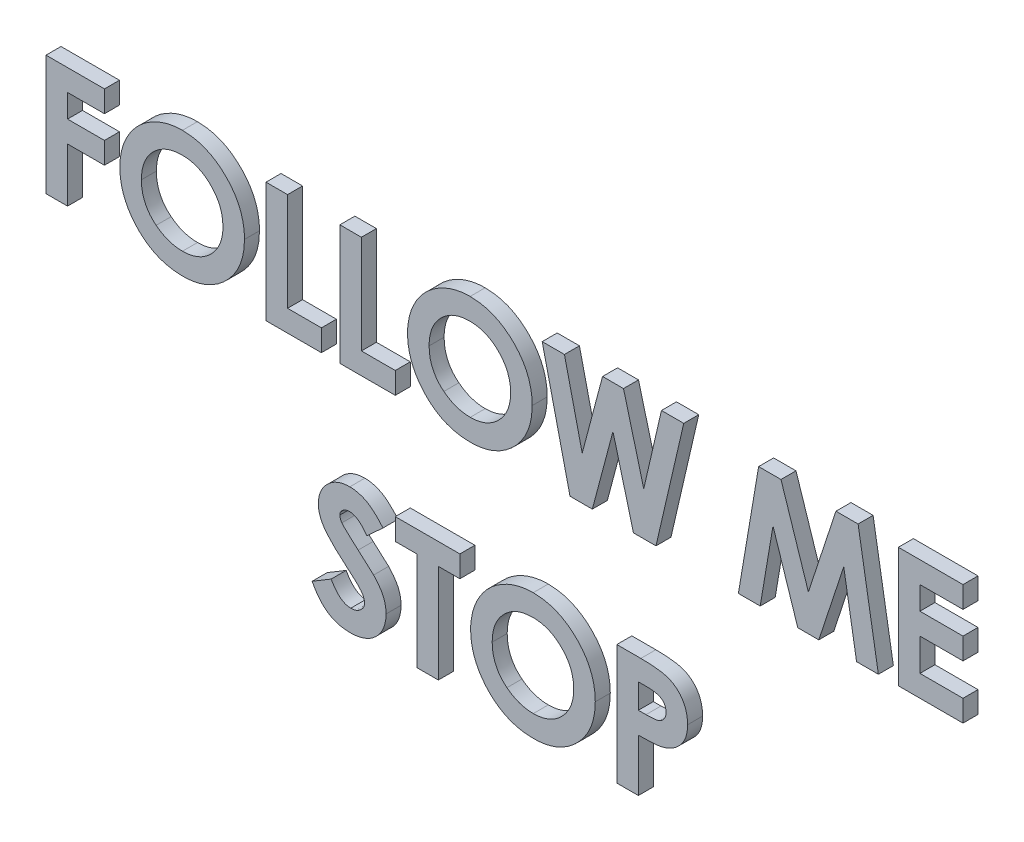
from build123d import *

# Parameters (mm, degrees)
BOSS_EXTRUDE1_DEPTH    = 1
BOSS_EXTRUDE1_2_DEPTH  = 1
BOSS_EXTRUDE1_3_DEPTH  = 1
BOSS_EXTRUDE1_4_DEPTH  = 1
BOSS_EXTRUDE1_5_DEPTH  = 1
BOSS_EXTRUDE1_6_DEPTH  = 1
BOSS_EXTRUDE1_7_DEPTH  = 1
BOSS_EXTRUDE1_8_DEPTH  = 1
BOSS_EXTRUDE1_9_DEPTH  = 1
BOSS_EXTRUDE1_10_DEPTH = 1
BOSS_EXTRUDE1_11_DEPTH = 1
BOSS_EXTRUDE1_12_DEPTH = 1


with BuildPart() as part:
    # Sketch1 → Boss-Extrude1 (new body)
    with BuildSketch(Plane.XY):
        Polygon((7.141025641, 29), (11.038461538, 29), (11.038461538, 27.564102564), (8.576923077, 27.564102564), (8.576923077, 26.025641026), (11.038461538, 26.025641026), (11.038461538, 24.58974359), (8.576923077, 24.58974359), (8.576923077, 21), (7.141025641, 21), align=None)
    extrude(amount=BOSS_EXTRUDE1_DEPTH)


with BuildPart() as body_2:
    # Sketch1 → Boss-Extrude1 2 (new body)
    with BuildSketch(Plane.XY):
        with BuildLine():
            add(Edge.make_bspline(
                [(16.233974359, 29.205128205), (16.373064163, 29.201526921), (16.647658941, 29.19441717), (17.051488767, 29.135151851), (17.440653473, 29.038587509), (17.814977079, 28.90435609), (18.173522321, 28.728821924), (18.517553909, 28.51696152), (18.845839539, 28.26477614), (19.155015201, 27.978148853), (19.440749275, 27.666454193), (19.688338016, 27.330859477), (19.899472611, 26.980060302), (20.074461529, 26.613116689), (20.207748161, 26.22748738), (20.301280903, 25.825138574), (20.361371056, 25.406184737), (20.368282348, 25.120934277), (20.371794872, 24.975961538)],
                knots=[0, 0, 0, 0, 1.014329547, 2.002516266, 2.970391464, 3.935626869, 4.897733899, 5.877609409, 6.878433252, 7.912639331, 8.949961323, 9.958554974, 10.949718813, 11.932905612, 12.9188844, 13.919928257, 14.942845884, 16, 16, 16, 16], degree=3))
            add(Edge.make_bspline(
                [(20.371794872, 24.975961538), (20.368054186, 24.832622308), (20.360683045, 24.550167754), (20.303734046, 24.135074742), (20.208626201, 23.73703593), (20.077600215, 23.35515035), (19.905784935, 22.991267724), (19.698767694, 22.643064713), (19.4510857, 22.313772723), (19.17177289, 22.003568465), (18.864273725, 21.721991539), (18.538583295, 21.473852359), (18.196205437, 21.263588582), (17.837641282, 21.091296519), (17.462121907, 20.957586994), (17.070574891, 20.863245208), (16.663024462, 20.8059118), (16.385870407, 20.798588806), (16.245192308, 20.794871795)],
                knots=[0, 0, 0, 0, 1.051557043, 2.072126891, 3.067553643, 4.050577992, 5.02905126, 6.015227836, 7.017913613, 8.04756643, 9.074058332, 10.072836633, 11.047628519, 12.017157415, 12.98668631, 13.966869689, 14.968021931, 16, 16, 16, 16], degree=3))
            add(Edge.make_bspline(
                [(16.245192308, 20.794871795), (16.098059884, 20.798206137), (15.808964783, 20.804757665), (15.385872809, 20.867059697), (14.980514139, 20.960908322), (14.596294021, 21.100972361), (14.229299499, 21.276064186), (13.882226992, 21.491700266), (13.555193138, 21.747524246), (13.250073856, 22.036984379), (12.973635048, 22.353717252), (12.729623577, 22.688317446), (12.523794488, 23.038228907), (12.35614025, 23.403615404), (12.223968384, 23.782206146), (12.130736149, 24.176306862), (12.075661644, 24.584972355), (12.067990085, 24.862546127), (12.064102564, 25.003205128)],
                knots=[0, 0, 0, 0, 1.067978421, 2.098431617, 3.099715153, 4.085208694, 5.062210972, 6.048429807, 7.046490867, 8.072918869, 9.098532598, 10.095778865, 11.076610158, 12.041847152, 13.011192615, 13.984257998, 14.978533688, 16, 16, 16, 16], degree=3))
            add(Edge.make_bspline(
                [(12.064102564, 25.003205128), (12.065322692, 25.097833141), (12.067747498, 25.285890958), (12.096956845, 25.564583044), (12.139009906, 25.837835435), (12.201204388, 26.104558669), (12.276754787, 26.366634355), (12.374641001, 26.621623027), (12.486062003, 26.872248666), (12.616246954, 27.115551069), (12.761000031, 27.349291651), (12.918938525, 27.572367816), (13.090459572, 27.782082248), (13.275010645, 27.979813103), (13.473227731, 28.164260682), (13.682503491, 28.338036098), (13.906896654, 28.496523257), (14.141495959, 28.643592732), (14.384978789, 28.776585108), (14.636353947, 28.88978424), (14.89044261, 28.988639115), (15.150639058, 29.066659753), (15.414154824, 29.130206746), (15.683805041, 29.172231464), (15.957153571, 29.201440001), (16.141481779, 29.203895886), (16.233974359, 29.205128205)],
                knots=[0, 0, 0, 0, 1.034744296, 2.056386356, 3.06226378, 4.057406941, 5.050368692, 6.043467995, 7.042652155, 8.049140477, 9.059438543, 10.048523776, 11.036952808, 12.020949711, 13.004946614, 13.997082645, 14.994316842, 16.007702937, 17.024872941, 18.026463647, 19.021641123, 20.005082605, 20.995858141, 21.984425357, 22.988620895, 24, 24, 24, 24], degree=3))
        make_face()
        with BuildLine():
            add(Edge.make_bspline(
                [(16.211538462, 27.769230769), (16.117931042, 27.766719072), (15.933187453, 27.761761987), (15.662202253, 27.723995701), (15.402046891, 27.663678651), (15.154163511, 27.576310141), (14.917477765, 27.465112201), (14.691570083, 27.330473372), (14.479568819, 27.167765593), (14.278647141, 26.985723921), (14.097147466, 26.782887662), (13.936786779, 26.565514114), (13.802590712, 26.333966289), (13.690200665, 26.090395209), (13.605595869, 25.832061984), (13.54533441, 25.560990165), (13.507251417, 25.276712682), (13.502451008, 25.082921092), (13.5, 24.983974359)],
                knots=[0, 0, 0, 0, 1.033739768, 2.040188636, 3.016340934, 3.979330865, 4.937572243, 5.900995986, 6.878200029, 7.884839167, 8.891893314, 9.879764717, 10.863503415, 11.843163062, 12.837761627, 13.859916423, 14.907309254, 16, 16, 16, 16], degree=3))
            add(Edge.make_bspline(
                [(13.5, 24.983974359), (13.503249662, 24.874319122), (13.509618462, 24.659413025), (13.554430113, 24.345913802), (13.631098388, 24.0498449), (13.741805885, 23.772654349), (13.879112227, 23.511264155), (14.049624911, 23.268878026), (14.250582439, 23.044044668), (14.405398491, 22.912777588), (14.483974359, 22.846153846)],
                knots=[0, 0, 0, 0, 1.078454662, 2.113592447, 3.107694534, 4.079536787, 5.043276885, 6.005368276, 6.987637804, 8, 8, 8, 8], degree=3))
            add(Edge.make_bspline(
                [(14.483974359, 22.846153846), (14.548342996, 22.796934785), (14.675630033, 22.699605575), (14.878807856, 22.574858227), (15.088041007, 22.467937305), (15.304908411, 22.381546465), (15.528952056, 22.313592882), (15.760141219, 22.266006106), (15.998148323, 22.236141288), (16.159099881, 22.232571877), (16.240384615, 22.230769231)],
                knots=[0, 0, 0, 0, 1.023928204, 2.024787132, 3.009472467, 3.9914905, 4.972207045, 5.96565515, 6.972602802, 8, 8, 8, 8], degree=3))
            add(Edge.make_bspline(
                [(16.240384615, 22.230769231), (16.332382454, 22.233302224), (16.513391093, 22.238285969), (16.779331758, 22.275587331), (17.034110991, 22.338714702), (17.279310485, 22.425316785), (17.514223194, 22.537910911), (17.737701035, 22.676725814), (17.950135825, 22.840057027), (18.150801532, 23.024489306), (18.334219474, 23.228124599), (18.494245522, 23.446657595), (18.632708353, 23.675273356), (18.742761247, 23.917207593), (18.830708587, 24.170176559), (18.890244769, 24.4353006), (18.928649477, 24.711486773), (18.933451238, 24.899441224), (18.935897436, 24.995192308)],
                knots=[0, 0, 0, 0, 1.026359118, 2.019393844, 2.989460624, 3.950973911, 4.916101784, 5.890408035, 6.881132271, 7.902007068, 8.92769091, 9.933912415, 10.920395702, 11.90457117, 12.894218921, 13.903490204, 14.931958862, 16, 16, 16, 16], degree=3))
            add(Edge.make_bspline(
                [(18.935897436, 24.995192308), (18.933366599, 25.090392797), (18.928385032, 25.27778044), (18.891018018, 25.55325654), (18.828290984, 25.817210136), (18.741428844, 26.070072291), (18.630510492, 26.312090904), (18.493348696, 26.542414895), (18.330424741, 26.760821597), (18.145488312, 26.965822652), (17.944196376, 27.154205489), (17.728089369, 27.317687547), (17.503214209, 27.459748258), (17.264411162, 27.571032883), (17.016565938, 27.659693107), (16.758166173, 27.724983769), (16.488233162, 27.761496677), (16.304592153, 27.766629759), (16.211538462, 27.769230769)],
                knots=[0, 0, 0, 0, 1.055025985, 2.07665775, 3.074803781, 4.057872707, 5.035505728, 6.020516407, 7.023567878, 8.050795229, 9.077271434, 10.074415901, 11.050397877, 12.019801805, 12.988065821, 13.964604439, 14.968634123, 16, 16, 16, 16], degree=3))
        make_face(mode=Mode.SUBTRACT)
    extrude(amount=BOSS_EXTRUDE1_2_DEPTH)


with BuildPart() as body_3:
    # Sketch1 → Boss-Extrude1 3 (new body)
    with BuildSketch(Plane.XY):
        Polygon((21.807692308, 29), (23.243589744, 29), (23.243589744, 22.435897436), (25.5, 22.435897436), (25.5, 21), (21.807692308, 21), align=None)
    extrude(amount=BOSS_EXTRUDE1_3_DEPTH)


with BuildPart() as body_4:
    # Sketch1 → Boss-Extrude1 4 (new body)
    with BuildSketch(Plane.XY):
        Polygon((26.730769231, 29), (28.166666667, 29), (28.166666667, 22.435897436), (30.423076923, 22.435897436), (30.423076923, 21), (26.730769231, 21), align=None)
    extrude(amount=BOSS_EXTRUDE1_4_DEPTH)


with BuildPart() as body_5:
    # Sketch1 → Boss-Extrude1 5 (new body)
    with BuildSketch(Plane.XY):
        with BuildLine():
            add(Edge.make_bspline(
                [(35.413461538, 29.205128205), (35.552551343, 29.201526921), (35.82714612, 29.19441717), (36.230975947, 29.135151851), (36.620140652, 29.038587509), (36.994464258, 28.90435609), (37.353009501, 28.728821924), (37.697041089, 28.51696152), (38.025326718, 28.26477614), (38.334502381, 27.978148853), (38.620236454, 27.666454193), (38.867825195, 27.330859477), (39.078959791, 26.980060302), (39.253948708, 26.613116689), (39.38723534, 26.22748738), (39.480768083, 25.825138574), (39.540858236, 25.406184737), (39.547769528, 25.120934277), (39.551282051, 24.975961538)],
                knots=[0, 0, 0, 0, 1.014329547, 2.002516266, 2.970391464, 3.935626869, 4.897733899, 5.877609409, 6.878433252, 7.912639331, 8.949961323, 9.958554974, 10.949718813, 11.932905612, 12.9188844, 13.919928257, 14.942845884, 16, 16, 16, 16], degree=3))
            add(Edge.make_bspline(
                [(39.551282051, 24.975961538), (39.547541366, 24.832622308), (39.540170225, 24.550167754), (39.483221226, 24.135074742), (39.38811338, 23.73703593), (39.257087394, 23.35515035), (39.085272114, 22.991267724), (38.878254873, 22.643064713), (38.63057288, 22.313772723), (38.351260069, 22.003568465), (38.043760905, 21.721991539), (37.718070475, 21.473852359), (37.375692617, 21.263588582), (37.017128462, 21.091296519), (36.641609087, 20.957586994), (36.25006207, 20.863245208), (35.842511642, 20.8059118), (35.565357586, 20.798588806), (35.424679487, 20.794871795)],
                knots=[0, 0, 0, 0, 1.051557043, 2.072126891, 3.067553643, 4.050577992, 5.02905126, 6.015227836, 7.017913613, 8.04756643, 9.074058332, 10.072836633, 11.047628519, 12.017157415, 12.98668631, 13.966869689, 14.968021931, 16, 16, 16, 16], degree=3))
            add(Edge.make_bspline(
                [(35.424679487, 20.794871795), (35.277547064, 20.798206137), (34.988451963, 20.804757665), (34.565359988, 20.867059697), (34.160001319, 20.960908322), (33.7757812, 21.100972361), (33.408786679, 21.276064186), (33.061714171, 21.491700266), (32.734680317, 21.747524246), (32.429561036, 22.036984379), (32.153122228, 22.353717252), (31.909110756, 22.688317446), (31.703281667, 23.038228907), (31.535627429, 23.403615404), (31.403455563, 23.782206146), (31.310223329, 24.176306862), (31.255148823, 24.584972355), (31.247477264, 24.862546127), (31.243589744, 25.003205128)],
                knots=[0, 0, 0, 0, 1.067978421, 2.098431617, 3.099715153, 4.085208694, 5.062210972, 6.048429807, 7.046490867, 8.072918869, 9.098532598, 10.095778865, 11.076610158, 12.041847152, 13.011192615, 13.984257998, 14.978533688, 16, 16, 16, 16], degree=3))
            add(Edge.make_bspline(
                [(31.243589744, 25.003205128), (31.244809872, 25.097833141), (31.247234678, 25.285890958), (31.276444024, 25.564583044), (31.318497085, 25.837835435), (31.380691567, 26.104558669), (31.456241966, 26.366634355), (31.55412818, 26.621623027), (31.665549183, 26.872248666), (31.795734133, 27.115551069), (31.94048721, 27.349291651), (32.098425705, 27.572367816), (32.269946752, 27.782082248), (32.454497824, 27.979813103), (32.652714911, 28.164260682), (32.86199067, 28.338036098), (33.086383833, 28.496523257), (33.320983138, 28.643592732), (33.564465968, 28.776585108), (33.815841127, 28.88978424), (34.069929789, 28.988639115), (34.330126238, 29.066659753), (34.593642004, 29.130206746), (34.86329222, 29.172231464), (35.136640751, 29.201440001), (35.320968959, 29.203895886), (35.413461538, 29.205128205)],
                knots=[0, 0, 0, 0, 1.034744296, 2.056386356, 3.06226378, 4.057406941, 5.050368692, 6.043467995, 7.042652155, 8.049140477, 9.059438543, 10.048523776, 11.036952808, 12.020949711, 13.004946614, 13.997082645, 14.994316842, 16.007702937, 17.024872941, 18.026463647, 19.021641123, 20.005082605, 20.995858141, 21.984425357, 22.988620895, 24, 24, 24, 24], degree=3))
        make_face()
        with BuildLine():
            add(Edge.make_bspline(
                [(35.391025641, 27.769230769), (35.297418221, 27.766719072), (35.112674632, 27.761761987), (34.841689432, 27.723995701), (34.58153407, 27.663678651), (34.33365069, 27.576310141), (34.096964945, 27.465112201), (33.871057263, 27.330473372), (33.659055998, 27.167765593), (33.45813432, 26.985723921), (33.276634646, 26.782887662), (33.116273958, 26.565514114), (32.982077891, 26.333966289), (32.869687845, 26.090395209), (32.785083049, 25.832061984), (32.724821589, 25.560990165), (32.686738596, 25.276712682), (32.681938188, 25.082921092), (32.679487179, 24.983974359)],
                knots=[0, 0, 0, 0, 1.033739768, 2.040188636, 3.016340934, 3.979330865, 4.937572243, 5.900995986, 6.878200029, 7.884839167, 8.891893314, 9.879764717, 10.863503415, 11.843163062, 12.837761627, 13.859916423, 14.907309254, 16, 16, 16, 16], degree=3))
            add(Edge.make_bspline(
                [(32.679487179, 24.983974359), (32.682736842, 24.874319122), (32.689105642, 24.659413025), (32.733917293, 24.345913802), (32.810585567, 24.0498449), (32.921293065, 23.772654349), (33.058599406, 23.511264155), (33.22911209, 23.268878026), (33.430069619, 23.044044668), (33.584885671, 22.912777588), (33.663461538, 22.846153846)],
                knots=[0, 0, 0, 0, 1.078454662, 2.113592447, 3.107694534, 4.079536787, 5.043276885, 6.005368276, 6.987637804, 8, 8, 8, 8], degree=3))
            add(Edge.make_bspline(
                [(33.663461538, 22.846153846), (33.727830175, 22.796934785), (33.855117212, 22.699605575), (34.058295036, 22.574858227), (34.267528186, 22.467937305), (34.48439559, 22.381546465), (34.708439235, 22.313592882), (34.939628398, 22.266006106), (35.177635503, 22.236141288), (35.338587061, 22.232571877), (35.419871795, 22.230769231)],
                knots=[0, 0, 0, 0, 1.023928204, 2.024787132, 3.009472467, 3.9914905, 4.972207045, 5.96565515, 6.972602802, 8, 8, 8, 8], degree=3))
            add(Edge.make_bspline(
                [(35.419871795, 22.230769231), (35.511869633, 22.233302224), (35.692878273, 22.238285969), (35.958818937, 22.275587331), (36.213598171, 22.338714702), (36.458797665, 22.425316785), (36.693710373, 22.537910911), (36.917188214, 22.676725814), (37.129623005, 22.840057027), (37.330288712, 23.024489306), (37.513706653, 23.228124599), (37.673732701, 23.446657595), (37.812195533, 23.675273356), (37.922248426, 23.917207593), (38.010195767, 24.170176559), (38.069731948, 24.4353006), (38.108136656, 24.711486773), (38.112938417, 24.899441224), (38.115384615, 24.995192308)],
                knots=[0, 0, 0, 0, 1.026359118, 2.019393844, 2.989460624, 3.950973911, 4.916101784, 5.890408035, 6.881132271, 7.902007068, 8.92769091, 9.933912415, 10.920395702, 11.90457117, 12.894218921, 13.903490204, 14.931958862, 16, 16, 16, 16], degree=3))
            add(Edge.make_bspline(
                [(38.115384615, 24.995192308), (38.112853778, 25.090392797), (38.107872212, 25.27778044), (38.070505198, 25.55325654), (38.007778164, 25.817210136), (37.920916024, 26.070072291), (37.809997671, 26.312090904), (37.672835876, 26.542414895), (37.509911921, 26.760821597), (37.324975492, 26.965822652), (37.123683555, 27.154205489), (36.907576549, 27.317687547), (36.682701388, 27.459748258), (36.443898341, 27.571032883), (36.196053117, 27.659693107), (35.937653352, 27.724983769), (35.667720341, 27.761496677), (35.484079332, 27.766629759), (35.391025641, 27.769230769)],
                knots=[0, 0, 0, 0, 1.055025985, 2.07665775, 3.074803781, 4.057872707, 5.035505728, 6.020516407, 7.023567878, 8.050795229, 9.077271434, 10.074415901, 11.050397877, 12.019801805, 12.988065821, 13.964604439, 14.968634123, 16, 16, 16, 16], degree=3))
        make_face(mode=Mode.SUBTRACT)
    extrude(amount=BOSS_EXTRUDE1_5_DEPTH)


with BuildPart() as body_6:
    # Sketch1 → Boss-Extrude1 6 (new body)
    with BuildSketch(Plane.XY):
        Polygon((40.217948718, 29), (41.700320513, 29), (42.884615385, 23.892628205), (44.241987179, 29), (45.637820513, 29), (46.987179487, 23.892628205), (48.168269231, 29), (49.653846154, 29), (47.802884615, 21), (46.302884615, 21), (44.935897436, 26.171474359), (43.560897436, 21), (42.072115385, 21), align=None)
    extrude(amount=BOSS_EXTRUDE1_6_DEPTH)


with BuildPart() as body_7:
    # Sketch1 → Boss-Extrude1 7 (new body)
    with BuildSketch(Plane.XY):
        Polygon((54.645833333, 29), (56.136217949, 29), (57.961538462, 23.419871795), (59.799679487, 29), (61.275641026, 29), (62.628205128, 21), (61.174679487, 21), (60.320512821, 26.052884615), (58.657051282, 21), (57.256410256, 21), (55.602564103, 26.052884615), (54.75, 21), (53.294871795, 21), align=None)
    extrude(amount=BOSS_EXTRUDE1_7_DEPTH)


with BuildPart() as body_8:
    # Sketch1 → Boss-Extrude1 8 (new body)
    with BuildSketch(Plane.XY):
        Polygon((63.961538462, 29), (68.269230769, 29), (68.269230769, 27.564102564), (65.397435897, 27.564102564), (65.397435897, 26.025641026), (68.269230769, 26.025641026), (68.269230769, 24.58974359), (65.397435897, 24.58974359), (65.397435897, 22.435897436), (68.269230769, 22.435897436), (68.269230769, 21), (63.961538462, 21), align=None)
    extrude(amount=BOSS_EXTRUDE1_8_DEPTH)


with BuildPart() as body_9:
    # Sketch1 → Boss-Extrude1 9 (new body)
    with BuildSketch(Plane.XY):
        with BuildLine():
            Line((29.602564103, 12.931089744), (28.528846154, 11.948717949))
            add(Edge.make_bspline(
                [(28.528846154, 11.948717949), (28.482852681, 12.013596524), (28.394551627, 12.13815434), (28.251424828, 12.304940193), (28.108944321, 12.447220936), (27.965790109, 12.564402189), (27.820693328, 12.655771987), (27.673905845, 12.720462813), (27.526259839, 12.761587385), (27.427064515, 12.766708384), (27.378205128, 12.769230769)],
                knots=[0, 0, 0, 0, 1.299362458, 2.494594718, 3.587462134, 4.587049575, 5.512617175, 6.380583204, 7.202344345, 8, 8, 8, 8], degree=3))
            add(Edge.make_bspline(
                [(27.378205128, 12.769230769), (27.332630494, 12.76763247), (27.244637848, 12.764546574), (27.119197804, 12.733873), (27.007830347, 12.680934914), (26.910644166, 12.611713914), (26.833658372, 12.528318657), (26.772191185, 12.440858475), (26.737579994, 12.344322214), (26.73302448, 12.278017215), (26.730769231, 12.245192308)],
                knots=[0, 0, 0, 0, 1.185010067, 2.2879431, 3.333075148, 4.379039566, 5.372662701, 6.27520591, 7.14612461, 8, 8, 8, 8], degree=3))
            add(Edge.make_bspline(
                [(26.730769231, 12.245192308), (26.732182481, 12.21189405), (26.735028572, 12.144835988), (26.762517929, 12.046554046), (26.80395224, 11.950521147), (26.843544415, 11.892061352), (26.863782051, 11.862179487)],
                knots=[0, 0, 0, 0, 0.967525499, 1.948461899, 2.951351359, 4, 4, 4, 4], degree=3))
            add(Edge.make_bspline(
                [(26.863782051, 11.862179487), (26.882180252, 11.838952626), (26.924530479, 11.78548746), (27.005283688, 11.70080697), (27.10669276, 11.597065958), (27.232660128, 11.477831774), (27.377956541, 11.338816288), (27.549316675, 11.185484254), (27.741808038, 11.013087156), (27.878626439, 10.89303606), (27.950320513, 10.830128205)],
                knots=[0, 0, 0, 0, 0.473873513, 1.090794244, 1.870441696, 2.795289791, 3.865433203, 5.087734844, 6.473946851, 8, 8, 8, 8], degree=3))
            add(Edge.make_bspline(
                [(27.950320513, 10.830128205), (28.017615714, 10.771887603), (28.145328024, 10.66135904), (28.327037281, 10.504481491), (28.486729454, 10.363342586), (28.626730895, 10.240060517), (28.744919317, 10.133341773), (28.841791585, 10.04267624), (28.918530831, 9.969829009), (28.962152598, 9.925829237), (28.980769231, 9.907051282)],
                knots=[0, 0, 0, 0, 1.543621617, 2.929473131, 4.163658386, 5.240097082, 6.164993805, 6.925417477, 7.541396219, 8, 8, 8, 8], degree=3))
            add(Edge.make_bspline(
                [(28.980769231, 9.907051282), (29.051396852, 9.830617069), (29.187167945, 9.68368367), (29.363622502, 9.45598311), (29.50885031, 9.233700934), (29.621201297, 9.012654544), (29.706053281, 8.789654678), (29.765875053, 8.559232278), (29.801702711, 8.318979574), (29.805680418, 8.155036433), (29.807692308, 8.072115385)],
                knots=[0, 0, 0, 0, 1.206664779, 2.319633467, 3.337109185, 4.282041471, 5.190008762, 6.099243693, 7.03861361, 8, 8, 8, 8], degree=3))
            add(Edge.make_bspline(
                [(29.807692308, 8.072115385), (29.806260296, 7.991318993), (29.803450635, 7.832793465), (29.769037681, 7.600814968), (29.719966827, 7.378801479), (29.644094679, 7.169168817), (29.551622154, 6.968475928), (29.435694489, 6.779848967), (29.299553342, 6.601378953), (29.143514684, 6.436256255), (28.970917399, 6.286418853), (28.785790409, 6.153030058), (28.586323446, 6.042900617), (28.374220727, 5.952216877), (28.149595784, 5.882371049), (27.912716214, 5.830748472), (27.663219694, 5.799765415), (27.492610378, 5.796526504), (27.405448718, 5.794871795)],
                knots=[0, 0, 0, 0, 1.043214005, 2.046824704, 3.02475056, 3.976699089, 4.921714032, 5.875962561, 6.831408892, 7.817874052, 8.806269674, 9.781291748, 10.760897367, 11.74438705, 12.757449933, 13.795994037, 14.874007457, 16, 16, 16, 16], degree=3))
            add(Edge.make_bspline(
                [(27.405448718, 5.794871795), (27.337027557, 5.796085632), (27.20151442, 5.798489725), (27.001788542, 5.818117146), (26.808930629, 5.849793716), (26.623157919, 5.895195702), (26.443633472, 5.952726176), (26.270349916, 6.022997447), (26.104503483, 6.107098693), (25.944839303, 6.203300457), (25.79213354, 6.315003377), (25.644455288, 6.439923723), (25.50327143, 6.579982827), (25.367903887, 6.734849454), (25.239218779, 6.904962148), (25.113003781, 7.087951777), (24.994868266, 7.287214378), (24.921890704, 7.426998705), (24.884615385, 7.498397436)],
                knots=[0, 0, 0, 0, 1.016823716, 2.013894106, 2.979844003, 3.91962641, 4.853723003, 5.779685073, 6.695824784, 7.614987388, 8.547259901, 9.504950863, 10.487499108, 11.500346958, 12.559593716, 13.656357062, 14.802919212, 16, 16, 16, 16], degree=3))
            Line((24.884615385, 7.498397436), (26.147435897, 8.256410256))
            add(Edge.make_bspline(
                [(26.147435897, 8.256410256), (26.19406175, 8.175363368), (26.283447495, 8.019989555), (26.434919996, 7.811225146), (26.590095841, 7.632452987), (26.752562555, 7.486832886), (26.920344605, 7.372417716), (27.094252416, 7.290648698), (27.274408174, 7.240033769), (27.397122091, 7.233852517), (27.458333333, 7.230769231)],
                knots=[0, 0, 0, 0, 1.283663364, 2.460892379, 3.537111102, 4.529833553, 5.449777664, 6.316464042, 7.160231139, 8, 8, 8, 8], degree=3))
            add(Edge.make_bspline(
                [(27.458333333, 7.230769231), (27.52059393, 7.233287209), (27.641388555, 7.238172454), (27.813807424, 7.283295991), (27.971887572, 7.354143253), (28.108530884, 7.455232527), (28.224231826, 7.571904913), (28.309625762, 7.701708277), (28.363270809, 7.842152384), (28.368942391, 7.939714099), (28.371794872, 7.988782051)],
                knots=[0, 0, 0, 0, 1.13588714, 2.203786484, 3.234766741, 4.283437687, 5.291419208, 6.222934724, 7.106237994, 8, 8, 8, 8], degree=3))
            add(Edge.make_bspline(
                [(28.371794872, 7.988782051), (28.369160723, 8.034431796), (28.363809701, 8.127164882), (28.324395721, 8.265044069), (28.26277965, 8.402860552), (28.189883493, 8.51590136), (28.115702526, 8.610547364), (28.044768789, 8.692553845), (27.958390262, 8.78315665), (27.856785962, 8.88246975), (27.741298348, 8.991367424), (27.611830136, 9.109839008), (27.466898778, 9.236840909), (27.364461008, 9.323353349), (27.310897436, 9.368589744)],
                knots=[0, 0, 0, 0, 0.916159276, 1.861089862, 2.860218735, 3.940849679, 4.552606315, 5.27541173, 6.11797699, 7.06649574, 8.129236253, 9.306560635, 10.591630461, 12, 12, 12, 12], degree=3))
            add(Edge.make_bspline(
                [(27.310897436, 9.368589744), (27.209070953, 9.454744713), (27.013635111, 9.620102176), (26.737459471, 9.864329943), (26.488600491, 10.09258317), (26.269207584, 10.307683565), (26.076485346, 10.505658723), (25.911738975, 10.688116674), (25.776778284, 10.856464831), (25.634761259, 11.055861957), (25.49981669, 11.298841056), (25.383186289, 11.59117308), (25.307521407, 11.883468011), (25.299044209, 12.079698729), (25.294871795, 12.176282051)],
                knots=[0, 0, 0, 0, 1.345494975, 2.582412109, 3.71882943, 4.751509156, 5.681369928, 6.505683931, 7.230279997, 7.856715994, 8.973648664, 10.023341002, 11.027102913, 12, 12, 12, 12], degree=3))
            add(Edge.make_bspline(
                [(25.294871795, 12.176282051), (25.296607097, 12.24477376), (25.300025827, 12.379709782), (25.330521433, 12.578113543), (25.376098277, 12.769556501), (25.442288939, 12.953340186), (25.528196426, 13.129234402), (25.632527732, 13.298100223), (25.756902925, 13.458383449), (25.897065371, 13.609977821), (26.051488501, 13.748517826), (26.21650924, 13.870793262), (26.391193555, 13.974068874), (26.574472817, 14.059743493), (26.767482731, 14.125321971), (26.968801402, 14.171807265), (27.178717584, 14.199455235), (27.32149804, 14.203213656), (27.394230769, 14.205128205)],
                knots=[0, 0, 0, 0, 1.010766082, 1.991317756, 2.957454644, 3.913069143, 4.869106762, 5.843196583, 6.838735724, 7.860187025, 8.887984031, 9.89767229, 10.887916223, 11.879572884, 12.879850636, 13.892031539, 14.926195476, 16, 16, 16, 16], degree=3))
            add(Edge.make_bspline(
                [(27.394230769, 14.205128205), (27.488488787, 14.201680046), (27.676260782, 14.194810946), (27.953887092, 14.141096832), (28.225060865, 14.056625729), (28.443577772, 13.954720636), (28.617447597, 13.856005125), (28.750702576, 13.765120318), (28.88629669, 13.661006885), (29.025323421, 13.54333674), (29.165199437, 13.409892822), (29.309902083, 13.263851868), (29.457459607, 13.103951742), (29.553348602, 12.989719834), (29.602564103, 12.931089744)],
                knots=[0, 0, 0, 0, 1.282922637, 2.555718331, 3.837320111, 5.142675274, 5.830281639, 6.55870424, 7.337177975, 8.157850921, 9.037902056, 9.96903443, 10.957596896, 12, 12, 12, 12], degree=3))
        make_face()
    extrude(amount=BOSS_EXTRUDE1_9_DEPTH)


with BuildPart() as body_10:
    # Sketch1 → Boss-Extrude1 10 (new body)
    with BuildSketch(Plane.XY):
        Polygon((30.423076923, 14), (34.730769231, 14), (34.730769231, 12.564102564), (33.294871795, 12.564102564), (33.294871795, 6), (31.858974359, 6), (31.858974359, 12.564102564), (30.423076923, 12.564102564), align=None)
    extrude(amount=BOSS_EXTRUDE1_10_DEPTH)


with BuildPart() as body_11:
    # Sketch1 → Boss-Extrude1 11 (new body)
    with BuildSketch(Plane.XY):
        with BuildLine():
            add(Edge.make_bspline(
                [(39.618589744, 14.205128205), (39.757679548, 14.201526921), (40.032274325, 14.19441717), (40.436104152, 14.135151851), (40.825268858, 14.038587509), (41.199592463, 13.90435609), (41.558137706, 13.728821924), (41.902169294, 13.51696152), (42.230454923, 13.26477614), (42.539630586, 12.978148853), (42.825364659, 12.666454193), (43.0729534, 12.330859477), (43.284087996, 11.980060302), (43.459076914, 11.613116689), (43.592363545, 11.22748738), (43.685896288, 10.825138574), (43.745986441, 10.406184737), (43.752897733, 10.120934277), (43.756410256, 9.975961538)],
                knots=[0, 0, 0, 0, 1.014329547, 2.002516266, 2.970391464, 3.935626869, 4.897733899, 5.877609409, 6.878433252, 7.912639331, 8.949961323, 9.958554974, 10.949718813, 11.932905612, 12.9188844, 13.919928257, 14.942845884, 16, 16, 16, 16], degree=3))
            add(Edge.make_bspline(
                [(43.756410256, 9.975961538), (43.752669571, 9.832622308), (43.74529843, 9.550167754), (43.688349431, 9.135074742), (43.593241585, 8.73703593), (43.462215599, 8.35515035), (43.290400319, 7.991267724), (43.083383078, 7.643064713), (42.835701085, 7.313772723), (42.556388275, 7.003568465), (42.24888911, 6.721991539), (41.92319868, 6.473852359), (41.580820822, 6.263588582), (41.222256667, 6.091296519), (40.846737292, 5.957586994), (40.455190276, 5.863245208), (40.047639847, 5.8059118), (39.770485791, 5.798588806), (39.629807692, 5.794871795)],
                knots=[0, 0, 0, 0, 1.051557043, 2.072126891, 3.067553643, 4.050577992, 5.02905126, 6.015227836, 7.017913613, 8.04756643, 9.074058332, 10.072836633, 11.047628519, 12.017157415, 12.98668631, 13.966869689, 14.968021931, 16, 16, 16, 16], degree=3))
            add(Edge.make_bspline(
                [(39.629807692, 5.794871795), (39.482675269, 5.798206137), (39.193580168, 5.804757665), (38.770488194, 5.867059697), (38.365129524, 5.960908322), (37.980909405, 6.100972361), (37.613914884, 6.276064186), (37.266842377, 6.491700266), (36.939808522, 6.747524246), (36.634689241, 7.036984379), (36.358250433, 7.353717252), (36.114238961, 7.688317446), (35.908409872, 8.038228907), (35.740755634, 8.403615404), (35.608583768, 8.782206146), (35.515351534, 9.176306862), (35.460277028, 9.584972355), (35.452605469, 9.862546127), (35.448717949, 10.003205128)],
                knots=[0, 0, 0, 0, 1.067978421, 2.098431617, 3.099715153, 4.085208694, 5.062210972, 6.048429807, 7.046490867, 8.072918869, 9.098532598, 10.095778865, 11.076610158, 12.041847152, 13.011192615, 13.984257998, 14.978533688, 16, 16, 16, 16], degree=3))
            add(Edge.make_bspline(
                [(35.448717949, 10.003205128), (35.449938077, 10.097833141), (35.452362883, 10.285890958), (35.481572229, 10.564583044), (35.52362529, 10.837835435), (35.585819772, 11.104558669), (35.661370171, 11.366634355), (35.759256386, 11.621623027), (35.870677388, 11.872248666), (36.000862338, 12.115551069), (36.145615415, 12.349291651), (36.30355391, 12.572367816), (36.475074957, 12.782082248), (36.659626029, 12.979813103), (36.857843116, 13.164260682), (37.067118875, 13.338036098), (37.291512039, 13.496523257), (37.526111344, 13.643592732), (37.769594173, 13.776585108), (38.020969332, 13.88978424), (38.275057994, 13.988639115), (38.535254443, 14.066659753), (38.798770209, 14.130206746), (39.068420425, 14.172231464), (39.341768956, 14.201440001), (39.526097164, 14.203895886), (39.618589744, 14.205128205)],
                knots=[0, 0, 0, 0, 1.034744296, 2.056386356, 3.06226378, 4.057406941, 5.050368692, 6.043467995, 7.042652155, 8.049140477, 9.059438543, 10.048523776, 11.036952808, 12.020949711, 13.004946614, 13.997082645, 14.994316842, 16.007702937, 17.024872941, 18.026463647, 19.021641123, 20.005082605, 20.995858141, 21.984425357, 22.988620895, 24, 24, 24, 24], degree=3))
        make_face()
        with BuildLine():
            add(Edge.make_bspline(
                [(39.596153846, 12.769230769), (39.502546426, 12.766719072), (39.317802837, 12.761761987), (39.046817637, 12.723995701), (38.786662275, 12.663678651), (38.538778896, 12.576310141), (38.30209315, 12.465112201), (38.076185468, 12.330473372), (37.864184203, 12.167765593), (37.663262525, 11.985723921), (37.481762851, 11.782887662), (37.321402163, 11.565514114), (37.187206096, 11.333966289), (37.07481605, 11.090395209), (36.990211254, 10.832061984), (36.929949794, 10.560990165), (36.891866801, 10.276712682), (36.887066393, 10.082921092), (36.884615385, 9.983974359)],
                knots=[0, 0, 0, 0, 1.033739768, 2.040188636, 3.016340934, 3.979330865, 4.937572243, 5.900995986, 6.878200029, 7.884839167, 8.891893314, 9.879764717, 10.863503415, 11.843163062, 12.837761627, 13.859916423, 14.907309254, 16, 16, 16, 16], degree=3))
            add(Edge.make_bspline(
                [(36.884615385, 9.983974359), (36.887865047, 9.874319122), (36.894233847, 9.659413025), (36.939045498, 9.345913802), (37.015713772, 9.0498449), (37.12642127, 8.772654349), (37.263727611, 8.511264155), (37.434240296, 8.268878026), (37.635197824, 8.044044668), (37.790013876, 7.912777588), (37.868589744, 7.846153846)],
                knots=[0, 0, 0, 0, 1.078454662, 2.113592447, 3.107694534, 4.079536787, 5.043276885, 6.005368276, 6.987637804, 8, 8, 8, 8], degree=3))
            add(Edge.make_bspline(
                [(37.868589744, 7.846153846), (37.93295838, 7.796934785), (38.060245417, 7.699605575), (38.263423241, 7.574858227), (38.472656391, 7.467937305), (38.689523796, 7.381546465), (38.913567441, 7.313592882), (39.144756603, 7.266006106), (39.382763708, 7.236141288), (39.543715266, 7.232571877), (39.625, 7.230769231)],
                knots=[0, 0, 0, 0, 1.023928204, 2.024787132, 3.009472467, 3.9914905, 4.972207045, 5.96565515, 6.972602802, 8, 8, 8, 8], degree=3))
            add(Edge.make_bspline(
                [(39.625, 7.230769231), (39.716997838, 7.233302224), (39.898006478, 7.238285969), (40.163947142, 7.275587331), (40.418726376, 7.338714702), (40.66392587, 7.425316785), (40.898838579, 7.537910911), (41.122316419, 7.676725814), (41.33475121, 7.840057027), (41.535416917, 8.024489306), (41.718834858, 8.228124599), (41.878860907, 8.446657595), (42.017323738, 8.675273356), (42.127376632, 8.917207593), (42.215323972, 9.170176559), (42.274860153, 9.4353006), (42.313264861, 9.711486773), (42.318066622, 9.899441224), (42.320512821, 9.995192308)],
                knots=[0, 0, 0, 0, 1.026359118, 2.019393844, 2.989460624, 3.950973911, 4.916101784, 5.890408035, 6.881132271, 7.902007068, 8.92769091, 9.933912415, 10.920395702, 11.90457117, 12.894218921, 13.903490204, 14.931958862, 16, 16, 16, 16], degree=3))
            add(Edge.make_bspline(
                [(42.320512821, 9.995192308), (42.317981984, 10.090392797), (42.313000417, 10.27778044), (42.275633403, 10.55325654), (42.212906369, 10.817210136), (42.126044229, 11.070072291), (42.015125876, 11.312090904), (41.877964081, 11.542414895), (41.715040126, 11.760821597), (41.530103697, 11.965822652), (41.328811761, 12.154205489), (41.112704754, 12.317687547), (40.887829593, 12.459748258), (40.649026546, 12.571032883), (40.401181322, 12.659693107), (40.142781557, 12.724983769), (39.872848546, 12.761496677), (39.689207537, 12.766629759), (39.596153846, 12.769230769)],
                knots=[0, 0, 0, 0, 1.055025985, 2.07665775, 3.074803781, 4.057872707, 5.035505728, 6.020516407, 7.023567878, 8.050795229, 9.077271434, 10.074415901, 11.050397877, 12.019801805, 12.988065821, 13.964604439, 14.968634123, 16, 16, 16, 16], degree=3))
        make_face(mode=Mode.SUBTRACT)
    extrude(amount=BOSS_EXTRUDE1_11_DEPTH)


with BuildPart() as body_12:
    # Sketch1 → Boss-Extrude1 12 (new body)
    with BuildSketch(Plane.XY):
        with BuildLine():
            Line((45.192307692, 14), (46.794871795, 14))
            add(Edge.make_bspline(
                [(46.794871795, 14), (46.899581254, 13.999531298), (47.10158775, 13.998627074), (47.392897737, 13.987662154), (47.661645463, 13.968012351), (47.907769184, 13.9437283), (48.1311677, 13.909683007), (48.332120773, 13.870652744), (48.510670106, 13.823102524), (48.668829107, 13.766661071), (48.810771702, 13.700118804), (48.945095177, 13.62924654), (49.068763808, 13.544662992), (49.188019524, 13.455484216), (49.296044269, 13.353190998), (49.399577274, 13.2445911), (49.494233633, 13.125377539), (49.58045195, 12.996993364), (49.658665249, 12.861810565), (49.726997619, 12.719587474), (49.782425011, 12.57009904), (49.828921701, 12.414312282), (49.866268295, 12.25223399), (49.891127377, 12.082867368), (49.908012916, 11.907394998), (49.909502832, 11.787968392), (49.91025641, 11.727564103)],
                knots=[0, 0, 0, 0, 1.698747864, 3.27724071, 4.728299578, 6.070144658, 7.288476769, 8.393259625, 9.389771311, 10.283485332, 11.113357557, 11.931608583, 12.74405601, 13.541433047, 14.344816069, 15.154114104, 15.974336324, 16.810834471, 17.661136416, 18.50621059, 19.367396281, 20.244825668, 21.142564693, 22.063065223, 23.020325768, 24, 24, 24, 24], degree=3))
            add(Edge.make_bspline(
                [(49.91025641, 11.727564103), (49.909166077, 11.660740276), (49.907023438, 11.529423244), (49.886018669, 11.336928587), (49.850135888, 11.153402359), (49.803238969, 10.977296851), (49.737844552, 10.81150939), (49.663134501, 10.652084235), (49.57121744, 10.503491179), (49.466187505, 10.363871501), (49.351482833, 10.232090028), (49.22438034, 10.111951699), (49.087302656, 10.002637538), (48.941043273, 9.903001921), (48.785053089, 9.813245838), (48.61944466, 9.732528816), (48.443087118, 9.663432438), (48.320277031, 9.627295592), (48.258012821, 9.608974359)],
                knots=[0, 0, 0, 0, 1.102006807, 2.165578795, 3.188629044, 4.184801286, 5.166646146, 6.124351954, 7.085497154, 8.042432466, 9.003981491, 9.963833307, 10.922997304, 11.89326795, 12.880200226, 13.889073926, 14.929769137, 16, 16, 16, 16], degree=3))
            add(Edge.make_bspline(
                [(48.258012821, 9.608974359), (48.21700203, 9.598770808), (48.128159451, 9.57666663), (47.981149385, 9.554225342), (47.811735719, 9.533591958), (47.619370629, 9.515860062), (47.40394321, 9.503806504), (47.165662053, 9.494393212), (46.904419174, 9.487548776), (46.722761206, 9.487305905), (46.628205128, 9.487179487)],
                knots=[0, 0, 0, 0, 0.618981996, 1.340914327, 2.176866532, 3.120127938, 4.170906482, 5.338178032, 6.614476169, 8, 8, 8, 8], degree=3))
            Line((46.628205128, 9.487179487), (46.628205128, 6))
            Line((46.628205128, 6), (45.192307692, 6))
            Line((45.192307692, 6), (45.192307692, 14))
        make_face()
        with BuildLine():
            Line((46.628205128, 10.923076923), (47.136217949, 10.923076923))
            add(Edge.make_bspline(
                [(47.136217949, 10.923076923), (47.228658902, 10.92366307), (47.398751629, 10.92474159), (47.631038228, 10.940337615), (47.817708208, 10.964155895), (47.965180959, 10.998316817), (48.081624663, 11.05016054), (48.182050068, 11.110133964), (48.268187502, 11.185968713), (48.342769841, 11.272622889), (48.402396174, 11.37219288), (48.44374393, 11.483057383), (48.47060262, 11.602887016), (48.473083269, 11.686280508), (48.474358974, 11.729166667)],
                knots=[0, 0, 0, 0, 1.8619151, 3.425951444, 4.686033666, 5.651700536, 6.461346321, 7.243864085, 7.999046032, 8.762387399, 9.539336099, 10.322741239, 11.137448474, 12, 12, 12, 12], degree=3))
            add(Edge.make_bspline(
                [(48.474358974, 11.729166667), (48.473096391, 11.766635745), (48.470646677, 11.839334764), (48.452650407, 11.944257482), (48.42396953, 12.0420671), (48.382412041, 12.131742126), (48.328688049, 12.213130187), (48.26318763, 12.286199222), (48.186751284, 12.352514066), (48.127737955, 12.387615526), (48.09775641, 12.405448718)],
                knots=[0, 0, 0, 0, 1.102301479, 2.1387299, 3.123554645, 4.094223062, 5.036071848, 5.982632524, 6.975082478, 8, 8, 8, 8], degree=3))
            add(Edge.make_bspline(
                [(48.09775641, 12.405448718), (48.072360311, 12.418292254), (48.018591564, 12.445484651), (47.927018176, 12.4770978), (47.821343884, 12.503766975), (47.700855268, 12.525902132), (47.566032991, 12.543081313), (47.416901109, 12.556219088), (47.25324016, 12.5615023), (47.139423762, 12.563211903), (47.080128205, 12.564102564)],
                knots=[0, 0, 0, 0, 0.656809284, 1.390599849, 2.23162475, 3.173112763, 4.218524733, 5.370385145, 6.63003504, 8, 8, 8, 8], degree=3))
            Line((47.080128205, 12.564102564), (46.628205128, 12.564102564))
            Line((46.628205128, 12.564102564), (46.628205128, 10.923076923))
        make_face(mode=Mode.SUBTRACT)
    extrude(amount=BOSS_EXTRUDE1_12_DEPTH)


solid = Compound([part.part, body_2.part, body_3.part, body_4.part, body_5.part, body_6.part, body_7.part, body_8.part, body_9.part, body_10.part, body_11.part, body_12.part])
